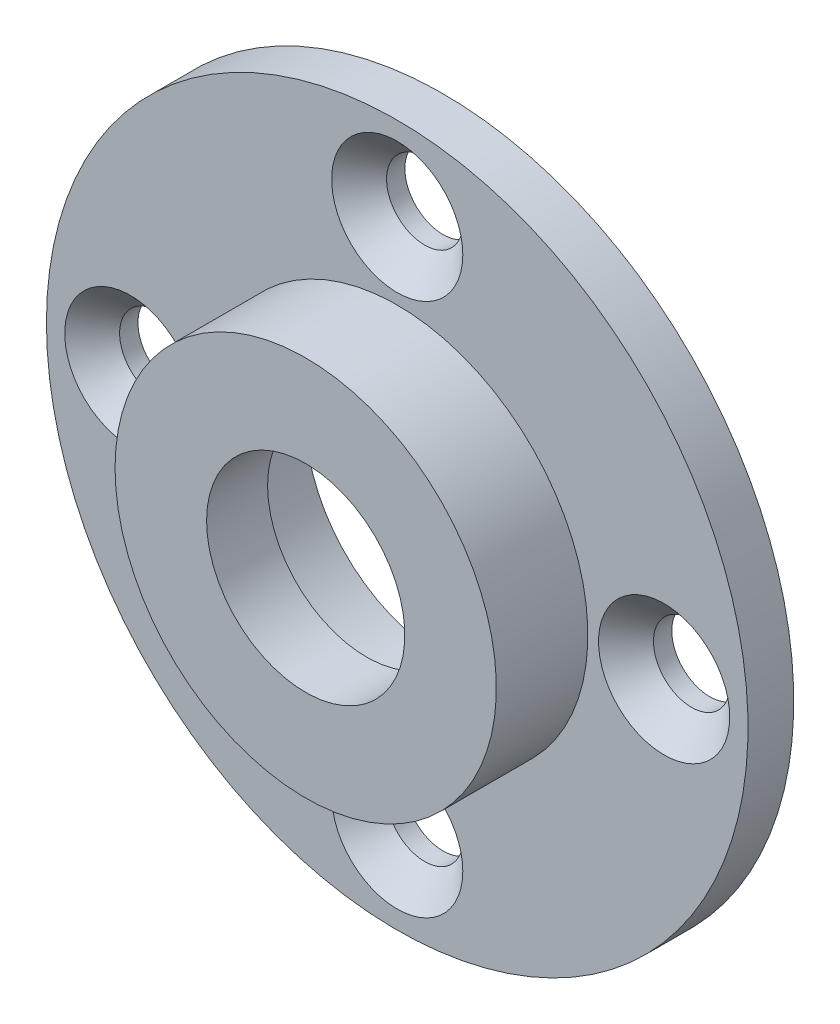
from build123d import *

# Parameters (mm, degrees)
RIPETIZIONECIRCOLARE1_COUNT = 4


with BuildPart() as part:
    # Schizzo1 → Rivoluzione1 (revolve)
    with BuildSketch(Plane(origin=(0, 0, 0), x_dir=(1, 0, 0), z_dir=(0, 1, 0)), mode=Mode.PRIVATE) as rivoluzione1_sk:
        Polygon((6.5, 0), (6.5, 4), (9, 4), (9, 9), (23, 9), (23, 6), (12.5, 6), (12.5, 0), align=None)
    revolve(rivoluzione1_sk.sketch.rotate(Axis((0, 0, -7.574324324), (0, 0, 1)), 180), axis=Axis((0, 0, -7.574324324), (0, 0, 1)))

    # Schizzo4 → Foro svasato per Vite M6-2 (revolve, cut)
    with BuildSketch(Plane(origin=(0, 17.5, -6), x_dir=(0, -1, 0), z_dir=(1, 0, 0))):
        Polygon((0, 0), (0, 3), (2.5, 3), (2.5, 1.8), (4.3, 0), align=None)
    foro_svasato_per_vite_m6_2 = revolve(axis=Axis((0, 17.5, 0.35), (0, 0, -1)), mode=Mode.SUBTRACT)

    # RipetizioneCircolare1: Foro svasato per Vite M6-2 ×4 about axis
    ripetizionecircolare1_axis = Axis((0, 0, 0), (0, 0, 1))
    for i in range(1, RIPETIZIONECIRCOLARE1_COUNT):
        add(foro_svasato_per_vite_m6_2.rotate(ripetizionecircolare1_axis, i * 360 / RIPETIZIONECIRCOLARE1_COUNT), mode=Mode.SUBTRACT)


solid = part.part
